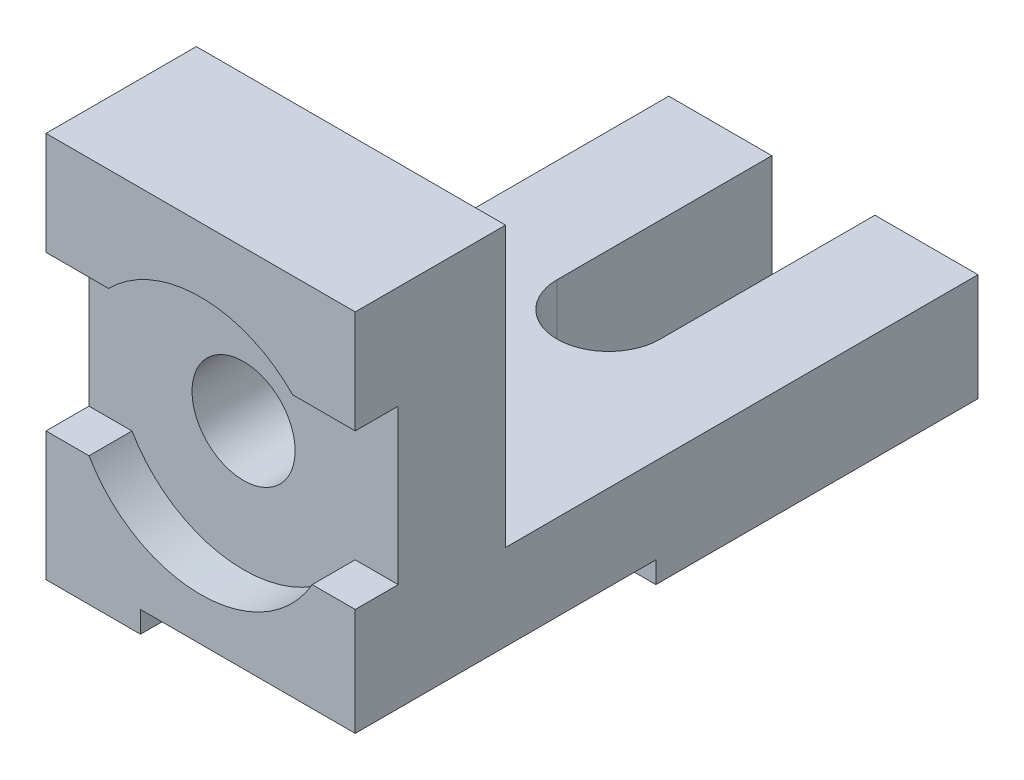
from build123d import *

# Parameters (mm, degrees)
BOSS_EXTRUDE1_DEPTH     = 72
CUT_EXTRUDE1_DEPTH      = 175.453432182
CUT_EXTRUDE1_DEPTH_BACK = 25
SKETCH3_R               = 30
CUT_EXTRUDE2_DEPTH      = 10
SKETCH4_R               = 12
CUT_EXTRUDE3_DEPTH      = 25
SKETCH5_W               = 50
SKETCH5_H               = 5
CUT_EXTRUDE4_DEPTH      = 70


with BuildPart() as part:
    # Sketch1 → Boss-Extrude1 (new body)
    with BuildSketch(Plane(origin=(0, 0, 0), x_dir=(0, 0, -1), z_dir=(1, 0, 0))):
        Polygon((0, 0), (145, 0), (145, 25), (35, 25), (35, 90), (0, 90), (0, 66), (10, 66), (10, 30), (0, 30), align=None)
    extrude(amount=-BOSS_EXTRUDE1_DEPTH)

    # Sketch2 → Cut-Extrude1 (cut, two sides: drawn at the far end of the back side and taken through both)
    with BuildSketch(Plane(origin=(0, 25, 0), x_dir=(1, 0, 0), z_dir=(0, 1, 0)).offset(-CUT_EXTRUDE1_DEPTH_BACK)):
        with BuildLine():
            Line((-24, 95), (-24, 145))
            Line((-24, 145), (-48, 145))
            Line((-48, 145), (-48, 95))
            ThreePointArc((-48, 95), (-36, 83), (-24, 95))
        make_face()
    extrude(amount=CUT_EXTRUDE1_DEPTH + CUT_EXTRUDE1_DEPTH_BACK, mode=Mode.SUBTRACT)

    # Sketch3 → Cut-Extrude2 (cut)
    with BuildSketch(Plane(origin=(0, 0, 0), x_dir=(-1, 0, 0), z_dir=(0, 0, -1))):
        with Locations((36, 45)):
            Circle(SKETCH3_R)
    extrude(amount=CUT_EXTRUDE2_DEPTH, mode=Mode.SUBTRACT)

    # Sketch4 → Cut-Extrude3 (cut)
    with BuildSketch(Plane.XY.offset(-10)):
        with Locations((-36, 45)):
            Circle(SKETCH4_R)
    extrude(amount=-CUT_EXTRUDE3_DEPTH, mode=Mode.SUBTRACT)

    # Sketch5 → Cut-Extrude4 (cut)
    with BuildSketch(Plane.XY):
        with Locations((-25, 2.5)):
            Rectangle(SKETCH5_W, SKETCH5_H)
    extrude(amount=-CUT_EXTRUDE4_DEPTH, mode=Mode.SUBTRACT)


solid = part.part
